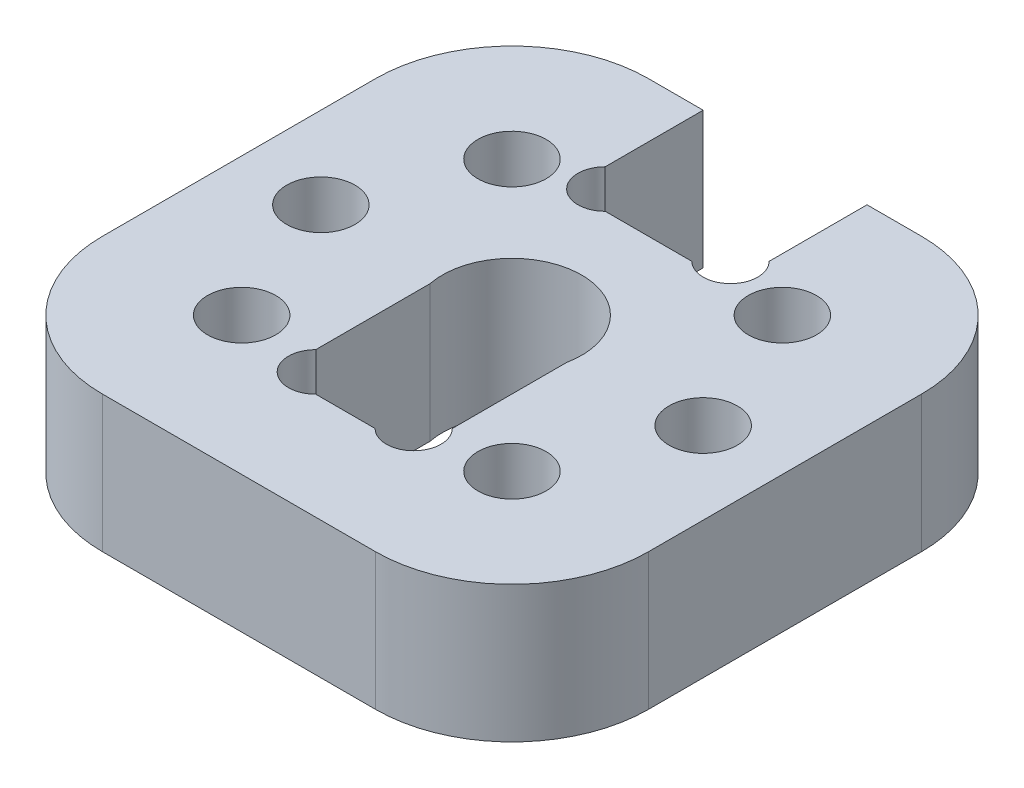
from build123d import *

# Parameters (mm, degrees)
SKETCH_1_W          = 20
SKETCH_1_H          = 20
EXTRUDE_1_DEPTH     = 5
SKETCH_2_R          = 2.55
CUT_EXTRUDE_1_DEPTH = 5
SKETCH_3_W          = 5
SKETCH_3_H          = 6.1
CUT_EXTRUDE_2_DEPTH = 5
SKETCH_5_R          = 1
CUT_EXTRUDE_4_DEPTH = 10
FILLET_1_R          = 5
SKETCH_6_W          = 6
SKETCH_6_H          = 5
CUT_EXTRUDE_5_DEPTH = 10
SKETCH_7_R          = 1
CUT_EXTRUDE_6_DEPTH = 10
SKETCH_8_R          = 1.25
CUT_EXTRUDE_7_DEPTH = 5


with BuildPart() as part:
    # 스케치1 → 보스-돌출1 (new body)
    with BuildSketch(Plane(origin=(0, 0, 0), x_dir=(1, 0, 0), z_dir=(0, 1, 0))):
        Rectangle(SKETCH_1_W, SKETCH_1_H)
    extrude(amount=EXTRUDE_1_DEPTH)

    # 스케치2 → 컷-돌출1 (cut)
    with BuildSketch(Plane(origin=(0, 5, 0), x_dir=(1, 0, 0), z_dir=(0, 1, 0))):
        with Locations(Location((0, 0, 0), (0, 0, 270))):
            Circle(SKETCH_2_R)
    extrude(amount=-CUT_EXTRUDE_1_DEPTH, mode=Mode.SUBTRACT)

    # 스케치3 → 컷-돌출2 (cut)
    with BuildSketch(Plane.XZ):
        with Locations((0, 3.05)):
            Rectangle(SKETCH_3_W, SKETCH_3_H)
    extrude(amount=-CUT_EXTRUDE_2_DEPTH, mode=Mode.SUBTRACT)

    # 스케치5 → 컷-돌출4 (cut)
    with BuildSketch(Plane(origin=(0, 0, 0), x_dir=(-1, 0, 0), z_dir=(0, -1, 0))):
        with Locations((-1.792893219, -5.392893219)):
            Circle(SKETCH_5_R)
        with Locations((1.792893219, -5.392893219)):
            Circle(SKETCH_5_R)
    extrude(amount=-CUT_EXTRUDE_4_DEPTH, mode=Mode.SUBTRACT)

    # 필렛1
    fillet_1_edges = [part.edges().sort_by_distance(p)[0] for p in [
        (10, 2.5, 10),
        (-10, 2.5, 10),
        (-10, 2.5, -10),
        (10, 2.5, -10),
    ]]
    fillet(fillet_1_edges, radius=FILLET_1_R)

    # 스케치6 → 컷-돌출5 (cut)
    with BuildSketch(Plane.XZ):
        with Locations((0, -7.5)):
            Rectangle(SKETCH_6_W, SKETCH_6_H)
    extrude(amount=-CUT_EXTRUDE_5_DEPTH, mode=Mode.SUBTRACT)

    # 스케치7 → 컷-돌출6 (cut)
    with BuildSketch(Plane(origin=(0, 0, 0), x_dir=(-1, 0, 0), z_dir=(0, -1, 0))):
        with Locations((-2.292893219, 5.707106781)):
            Circle(SKETCH_7_R)
        with Locations((2.292893219, 5.707106781)):
            Circle(SKETCH_7_R)
    extrude(amount=-CUT_EXTRUDE_6_DEPTH, mode=Mode.SUBTRACT)

    # 스케치8 → 컷-돌출7 (cut)
    with BuildSketch(Plane.XZ):
        with Locations(Location((4.949747468, 4.949747468, 0), (0, 0, 270))):
            Circle(SKETCH_8_R)
        with Locations(Location((7, 0, 0), (0, 0, 270))):
            Circle(SKETCH_8_R)
        with Locations(Location((4.949747468, -4.949747468, 0), (0, 0, 270))):
            Circle(SKETCH_8_R)
        with Locations(Location((-4.949747468, -4.949747468, 0), (0, 0, 270))):
            Circle(SKETCH_8_R)
        with Locations(Location((-7, 0, 0), (0, 0, 270))):
            Circle(SKETCH_8_R)
        with Locations(Location((-4.949747468, 4.949747468, 0), (0, 0, 270))):
            Circle(SKETCH_8_R)
    extrude(amount=-CUT_EXTRUDE_7_DEPTH, mode=Mode.SUBTRACT)


solid = part.part
